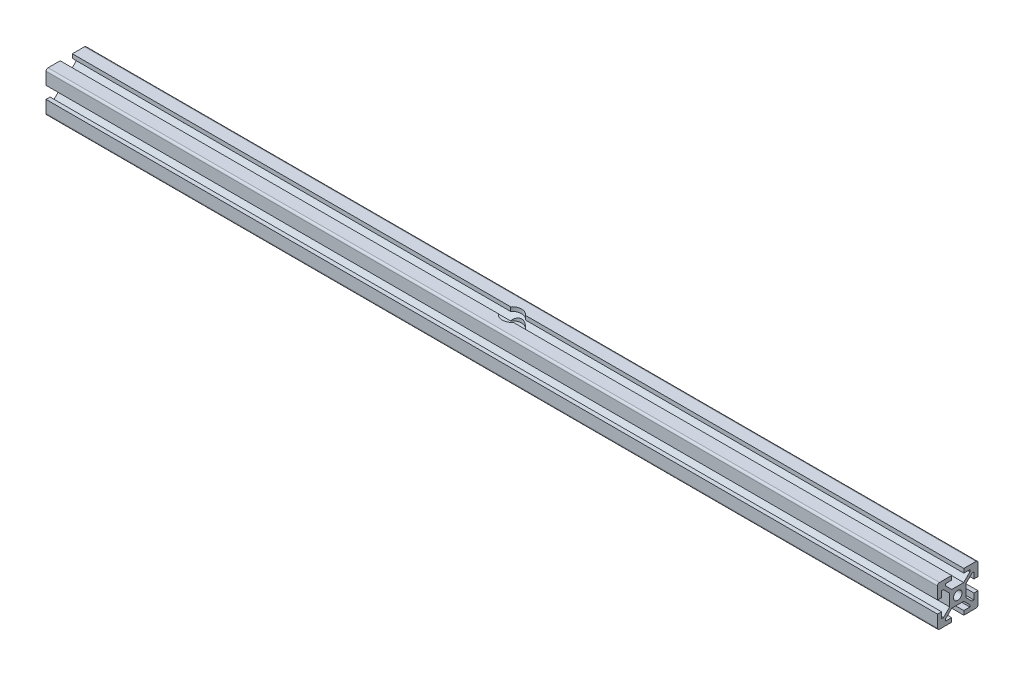
from build123d import *

# Parameters (mm, degrees)
SKETCH1_R           = 2.1
BOSS_EXTRUDE1_DEPTH = 440


with BuildPart() as part:
    # Sketch1 → Boss-Extrude1 (new body)
    with BuildSketch(Plane(origin=(0, 0, 0), x_dir=(0, 0, -1), z_dir=(1, 0, 0))):
        with BuildLine():
            Line((-10, 9), (-10, 3))
            Line((-10, 3), (-8, 3))
            Line((-8, 3), (-8, 6))
            Line((-8, 6), (-7.060660172, 6))
            Line((-7.060660172, 6), (-4, 2.939339828))
            Line((-4, 2.939339828), (-4, -2.939339828))
            Line((-4, -2.939339828), (-7.060660172, -6))
            Line((-7.060660172, -6), (-8, -6))
            Line((-8, -6), (-8, -3))
            Line((-8, -3), (-10, -3))
            Line((-10, -3), (-10, -9))
            ThreePointArc((-10, -9), (-9.707106781, -9.707106781), (-9, -10))
            Line((-9, -10), (-3, -10))
            Line((-3, -10), (-3, -8))
            Line((-3, -8), (-6, -8))
            Line((-6, -8), (-6, -7.060660172))
            Line((-6, -7.060660172), (-2.939339828, -4))
            Line((-2.939339828, -4), (2.939339828, -4))
            Line((2.939339828, -4), (6, -7.060660172))
            Line((6, -7.060660172), (6, -8))
            Line((6, -8), (3, -8))
            Line((3, -8), (3, -10))
            Line((3, -10), (9, -10))
            ThreePointArc((9, -10), (9.707106781, -9.707106781), (10, -9))
            Line((10, -9), (10, -3))
            Line((10, -3), (8, -3))
            Line((8, -3), (8, -6))
            Line((8, -6), (7.060660172, -6))
            Line((7.060660172, -6), (4, -2.939339828))
            Line((4, -2.939339828), (4, 2.939339828))
            Line((4, 2.939339828), (7.060660172, 6))
            Line((7.060660172, 6), (8, 6))
            Line((8, 6), (8, 3))
            Line((8, 3), (10, 3))
            Line((10, 3), (10, 9))
            ThreePointArc((10, 9), (9.707106781, 9.707106781), (9, 10))
            Line((9, 10), (3, 10))
            Line((3, 10), (3, 8))
            Line((3, 8), (6, 8))
            Line((6, 8), (6, 7.060660172))
            Line((6, 7.060660172), (2.939339828, 4))
            Line((2.939339828, 4), (-2.939339828, 4))
            Line((-2.939339828, 4), (-6, 7.060660172))
            Line((-6, 7.060660172), (-6, 8))
            Line((-6, 8), (-3, 8))
            Line((-3, 8), (-3, 10))
            Line((-3, 10), (-9, 10))
            ThreePointArc((-9, 10), (-9.707106781, 9.707106781), (-10, 9))
        make_face()
        Circle(SKETCH1_R, mode=Mode.SUBTRACT)
    extrude(amount=BOSS_EXTRUDE1_DEPTH)

    # Sketch80 → Cut-Revolve1 (revolve, cut)
    with BuildSketch(Plane.XY):
        Polygon((220, -10), (222.75, -10), (222.75, 4), (224.75, 4), (224.75, 10), (220, 10), align=None)
    revolve(axis=Axis((220, 10, 0), (0, -1, 0)), mode=Mode.SUBTRACT)


solid = part.part
